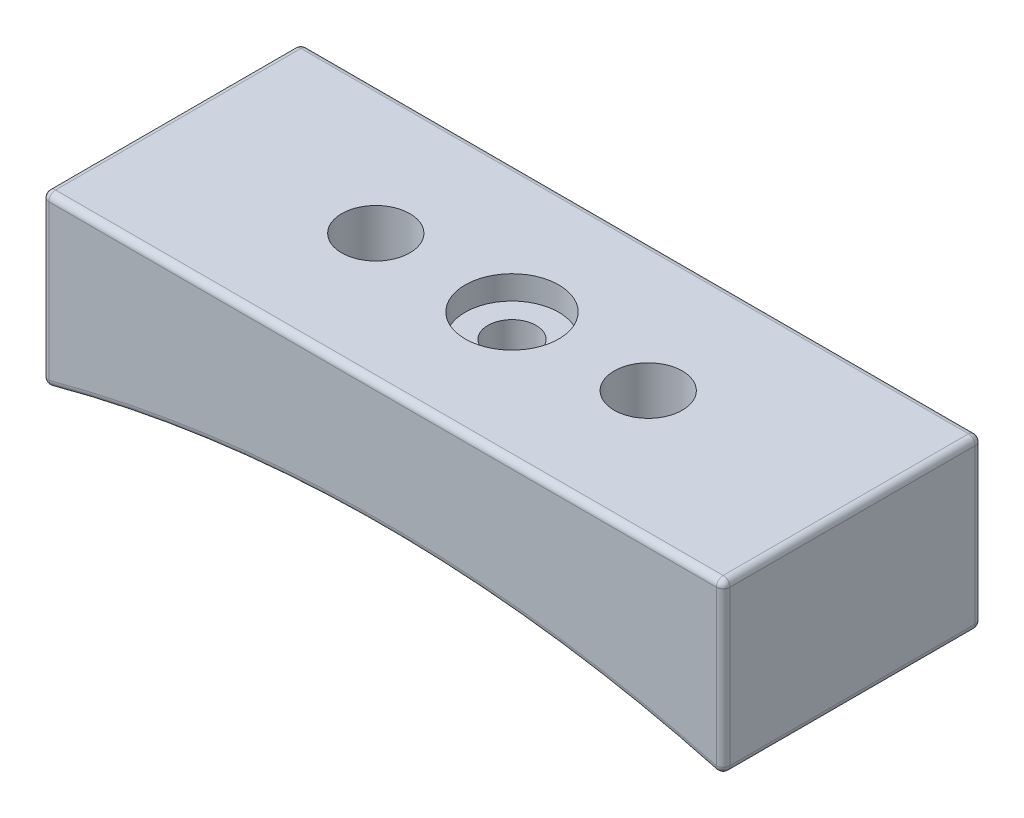
from build123d import *

# Parameters (mm, degrees)
BOSS_EXTRUDE1_DEPTH                            = 24.13
CBORE_FOR_8_BUTTON_HEAD_CAP_SCREW1_D           = 4.4958
CBORE_FOR_8_BUTTON_HEAD_CAP_SCREW1_CBORE_D     = 8.73252
CBORE_FOR_8_BUTTON_HEAD_CAP_SCREW1_CBORE_DEPTH = 2.2098
CUT_EXTRUDE1_DEPTH                             = 42.512826714
CUT_EXTRUDE1_DEPTH_BACK                        = 42.512826714
SKETCH6_R                                      = 3.175
CUT_EXTRUDE2_DEPTH                             = 42.512826714
CUT_EXTRUDE2_DEPTH_BACK                        = 5.588
SKETCH7_R                                      = 8.128
FILLET1_R                                      = 0.635


with BuildPart() as part:
    # Sketch1 → Boss-Extrude1 (new body)
    with BuildSketch(Plane.XY):
        with BuildLine():
            Line((-31.75, 12.7), (31.75, 12.7))
            Line((31.75, 12.7), (31.75, -3.175))
            ThreePointArc((31.75, -3.175), (0, 1.167638116), (-31.75, -3.175))
            Line((-31.75, -3.175), (-31.75, 12.7))
        make_face()
    extrude(amount=BOSS_EXTRUDE1_DEPTH)

    # CBORE for #8 Button Head Cap Screw1 (through all)
    with Locations(Plane(origin=(0, 12.7, 0), x_dir=(1, 0, 0), z_dir=(0, 1, 0))):
        with Locations((0, -12.065)):
            CounterBoreHole(CBORE_FOR_8_BUTTON_HEAD_CAP_SCREW1_D / 2, CBORE_FOR_8_BUTTON_HEAD_CAP_SCREW1_CBORE_D / 2, CBORE_FOR_8_BUTTON_HEAD_CAP_SCREW1_CBORE_DEPTH)

    # Sketch6 → Cut-Extrude1 (cut, two sides: drawn at the far end of the back side and taken through both)
    with BuildSketch(Plane(origin=(0, 1.167638116, 0), x_dir=(-1, 0, 0), z_dir=(0, -1, 0)).offset(-CUT_EXTRUDE1_DEPTH_BACK)):
        with Locations(Location((12.7, -12.065, 0), (0, 0, 90))):
            Circle(SKETCH6_R)
        with Locations(Location((-12.7, -12.065, 0), (0, 0, 90))):
            Circle(SKETCH6_R)
    extrude(amount=CUT_EXTRUDE1_DEPTH + CUT_EXTRUDE1_DEPTH_BACK, mode=Mode.SUBTRACT)

    # Sketch7 → Cut-Extrude2 (cut, two sides: drawn at the far end of the back side and taken through both)
    with BuildSketch(Plane(origin=(0, 1.167638116, 0), x_dir=(-1, 0, 0), z_dir=(0, -1, 0)).offset(-CUT_EXTRUDE2_DEPTH_BACK)):
        with Locations(Location((12.7, -12.065, 0), (0, 0, 270))):
            Circle(SKETCH7_R)
        with Locations(Location((-12.7, -12.065, 0), (0, 0, 270))):
            Circle(SKETCH7_R)
    extrude(amount=CUT_EXTRUDE2_DEPTH + CUT_EXTRUDE2_DEPTH_BACK, mode=Mode.SUBTRACT)

    # Fillet1
    fillet1_edges = [part.edges().sort_by_distance(p)[0] for p in [
        (0, 12.7, 24.13),
        (-31.75, 4.7625, 24.13),
        (0, 1.167638116, 24.13),
        (-31.75, 4.7625, 0),
        (0, 12.7, 0),
        (31.75, 4.7625, 0),
        (0, 1.167638116, 0),
        (31.75, 4.7625, 24.13),
        (-31.75, -3.175, 12.065),
        (-31.75, 12.7, 12.065),
        (31.75, 12.7, 12.065),
        (31.75, -3.175, 12.065),
    ]]
    fillet(fillet1_edges, radius=FILLET1_R)


solid = part.part
